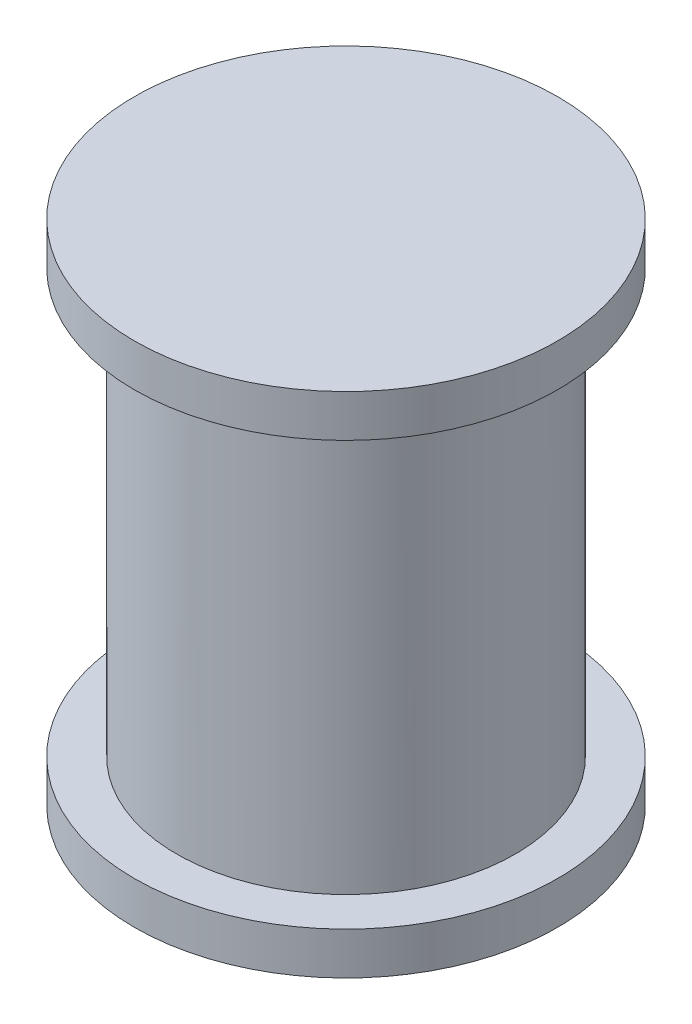
from build123d import *

# Parameters (mm, degrees)
CROQUIS1_R              = 4
SALIENTE_EXTRUIR1_DEPTH = 10
CROQUIS2_R              = 5
SALIENTE_EXTRUIR2_DEPTH = 1
SALIENTE_EXTRUIR3_START = 1
CROQUIS3_R              = 5
SALIENTE_EXTRUIR3_DEPTH = 1


with BuildPart() as part:
    # Croquis1 → Saliente-Extruir1 (new body)
    with BuildSketch(Plane(origin=(0, 0, 0), x_dir=(1, 0, 0), z_dir=(0, 1, 0))):
        with Locations(Location((0, 0, 0), (0, 0, 270))):
            Circle(CROQUIS1_R)
    extrude(amount=SALIENTE_EXTRUIR1_DEPTH)

    # Croquis2 → Saliente-Extruir2 (add)
    with BuildSketch(Plane(origin=(0, 10, 0), x_dir=(1, 0, 0), z_dir=(0, 1, 0))):
        with Locations(Location((0, 0, 0), (0, 0, 270))):
            Circle(CROQUIS2_R)
    extrude(amount=SALIENTE_EXTRUIR2_DEPTH)

    # Croquis3 → Saliente-Extruir3 (add)
    with BuildSketch(Plane.XZ.offset(SALIENTE_EXTRUIR3_START)):
        with Locations(Location((0, 0, 0), (0, 0, 90))):
            Circle(CROQUIS3_R)
    extrude(amount=-SALIENTE_EXTRUIR3_DEPTH)


solid = part.part
